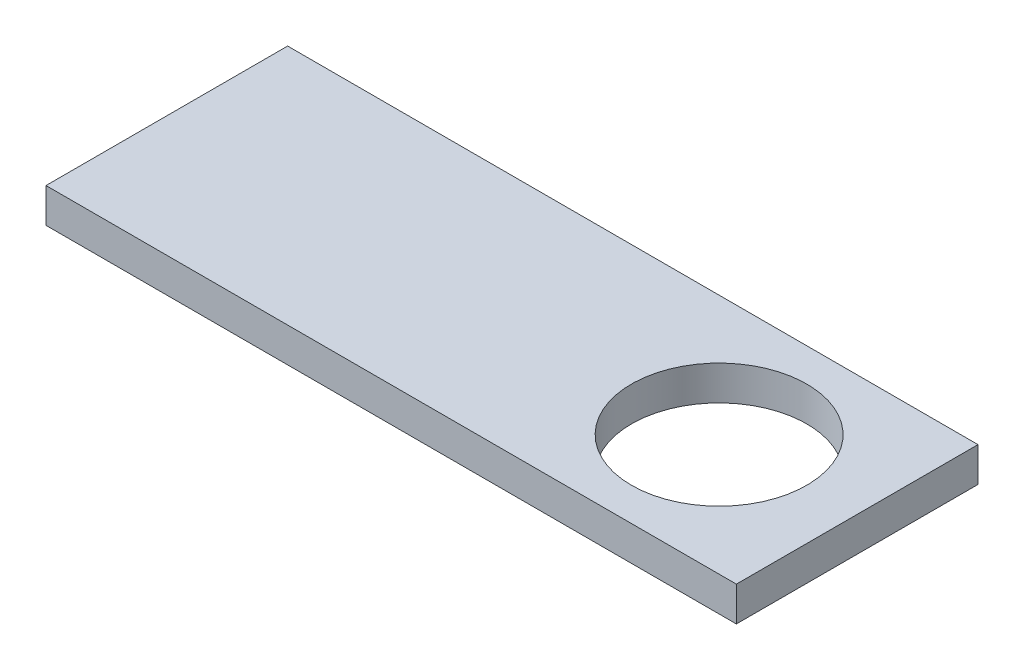
from build123d import *

# Parameters (mm, degrees)
SKETCH2_W           = 200
SKETCH2_H           = 70
SKETCH2_R           = 25.4
BOSS_EXTRUDE1_DEPTH = 5


with BuildPart() as part:
    # Sketch2 → Boss-Extrude1 (new, symmetric)
    with BuildSketch(Plane(origin=(0, 0, 0), x_dir=(1, 0, 0), z_dir=(0, 1, 0))):
        Rectangle(SKETCH2_W, SKETCH2_H)
        with Locations(Location((60, 0, 0), (0, 0, 270))):
            Circle(SKETCH2_R, mode=Mode.SUBTRACT)
    extrude(amount=BOSS_EXTRUDE1_DEPTH, both=True)


solid = part.part
